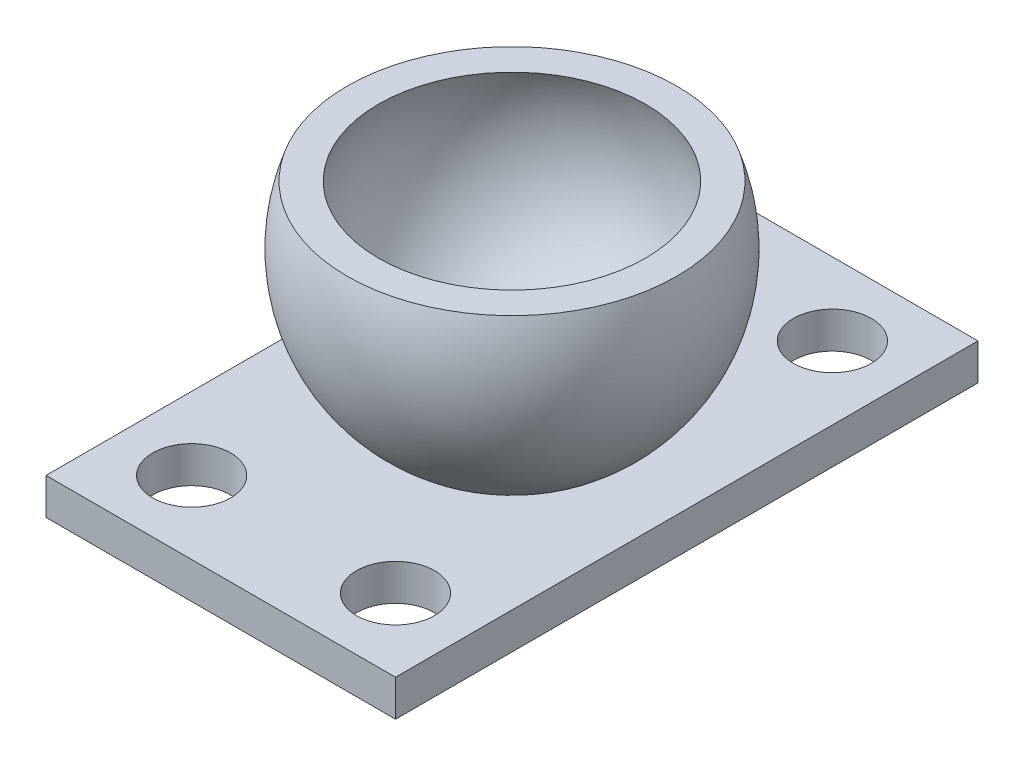
from build123d import *

# Parameters (mm, degrees)
SKETCH2_W            = 17.78
SKETCH2_H            = 6.35
CUT_EXTRUDE1_DEPTH   = 12.7
SHELL1_T             = -1.27
SKETCH3_W            = 15.24
SKETCH3_H            = 25.4
BOSS_EXTRUDE1_DEPTH  = 1.5875
M3_CLEARANCE_HOLE1_D = 3.4


with BuildPart() as part:
    # Sketch1 → Revolve1 (revolve)
    with BuildSketch(Plane.XY):
        with BuildLine():
            Line((0, 7.62), (0, -7.62))
            ThreePointArc((0, -7.62), (7.62, 0), (0, 7.62))
        make_face()
    revolve(axis=Axis((0, 7.62, 0), (0, -1, 0)))

    # Sketch2 → Cut-Extrude1 (cut, symmetric)
    with BuildSketch(Plane.XY):
        with Locations((0, 5.715)):
            Rectangle(SKETCH2_W, SKETCH2_H)
    extrude(amount=CUT_EXTRUDE1_DEPTH, both=True, mode=Mode.SUBTRACT)

    # Shell1
    shell1_openings = [part.faces().sort_by_distance(p)[0] for p in [
        (0, 2.54, 0),
    ]]
    offset(amount=SHELL1_T, openings=shell1_openings, kind=Kind.INTERSECTION)

    # Sketch3 → Boss-Extrude1 (add)
    with BuildSketch(Plane(origin=(0, -7.62, 0), x_dir=(1, 0, 0), z_dir=(0, 1, 0))):
        Rectangle(SKETCH3_W, SKETCH3_H)
    extrude(amount=BOSS_EXTRUDE1_DEPTH)

    # M3 Clearance Hole1 (through all)
    with Locations(Plane(origin=(0, -6.0325, 0), x_dir=(1, 0, 0), z_dir=(0, 1, 0))):
        with Locations((-4.445, -9.525), (-4.445, 9.525), (4.445, 9.525), (4.445, -9.525)):
            Hole(M3_CLEARANCE_HOLE1_D / 2)


solid = part.part
